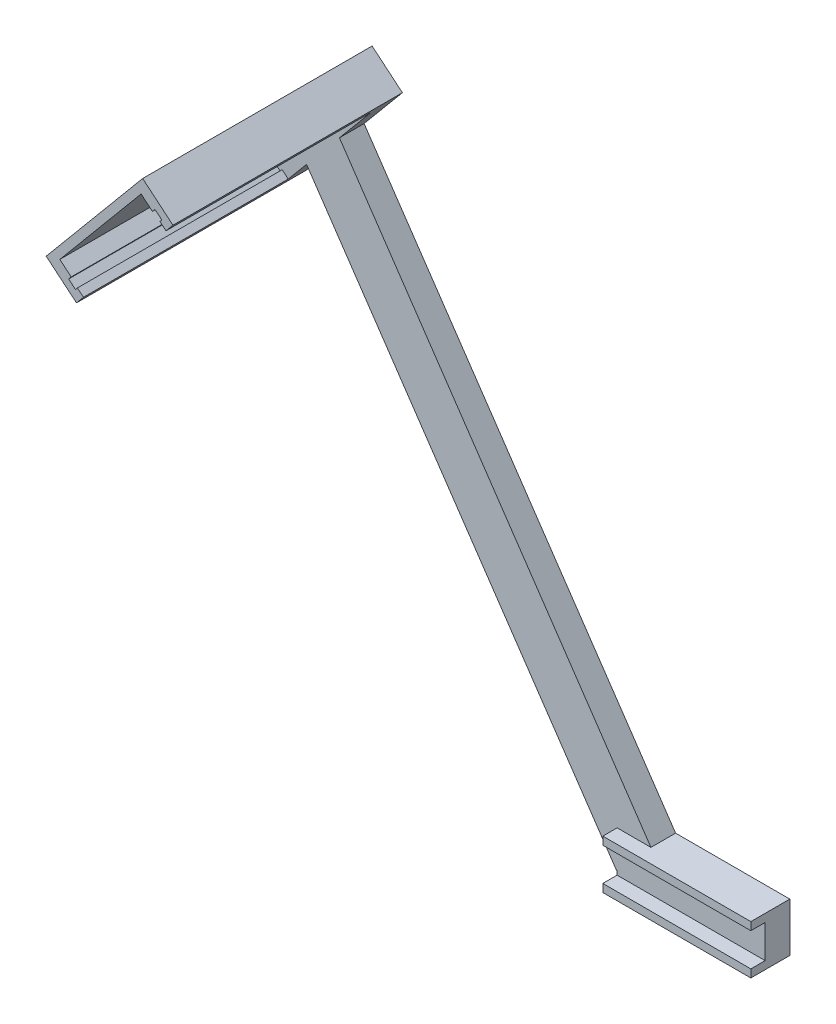
from build123d import *

# Parameters (mm, degrees)
CROQUIS_PLACA_CLIP_W = 30
CROQUIS_PLACA_CLIP_H = 9.9
PLACA_CLIP_DEPTH     = 5
CROQUIS_MORDAZAS_W   = 30
CROQUIS_MORDAZAS_H   = 1.6
MORDAZAS_DEPTH       = 2.9
BRAZO_DEPTH          = 5
TOPE_CUNA_DEPTH      = 5
CUNA_DEPTH           = 46.5


with BuildPart() as part:
    # Croquis_placa_clip → Placa_clip (new body)
    with BuildSketch(Plane.XY.offset(-133.1)):
        with Locations((-39, 79.75)):
            Rectangle(CROQUIS_PLACA_CLIP_W, CROQUIS_PLACA_CLIP_H)
    extrude(amount=PLACA_CLIP_DEPTH)

    # Croquis_mordazas → Mordazas (add)
    with BuildSketch(Plane.XY.offset(-128.1)):
        with Locations((-39, 83.9)):
            Rectangle(CROQUIS_MORDAZAS_W, CROQUIS_MORDAZAS_H)
        with Locations((-39, 75.6)):
            Rectangle(CROQUIS_MORDAZAS_W, CROQUIS_MORDAZAS_H)
    extrude(amount=MORDAZAS_DEPTH)

    # Croquis_brazo → Brazo (add)
    with BuildSketch(Plane.XY.offset(-133.1)):
        Polygon((-54.136621543, 77.191377169), (-121.944749796, 177.06116426), (-113.671506709, 182.678409922), (-45.863378457, 82.808622831), align=None)
    extrude(amount=BRAZO_DEPTH)

    # Croquis_tope → Tope_cuna (add)
    with BuildSketch(Plane.XY.offset(-133.1)):
        Polygon((-128.196522897, 168.676764411), (-108.647880385, 192.088312329), (-102.507146505, 186.960799539), (-122.055789016, 163.549251621), align=None)
    extrude(amount=TOPE_CUNA_DEPTH)

    # Croquis_cuna → Cuna (add)
    with BuildSketch(Plane.XY.offset(-133.1)):
        Polygon((-108.647880385, 192.088312329), (-102.507146505, 186.960799539), (-103.917212522, 185.272097722), (-105.145359298, 186.29760028), (-104.760795839, 186.758155321), (-106.142460962, 187.911845699), (-106.655212241, 187.297772311), (-108.957987446, 189.220589607), (-125.430122284, 169.493482017), (-123.127347079, 167.570664721), (-123.640098358, 166.956591333), (-122.258433235, 165.802900955), (-121.873869775, 166.263455996), (-120.645722999, 165.237953438), (-122.055789016, 163.549251621), (-128.196522897, 168.676764411), align=None)
    extrude(amount=CUNA_DEPTH)


solid = part.part
